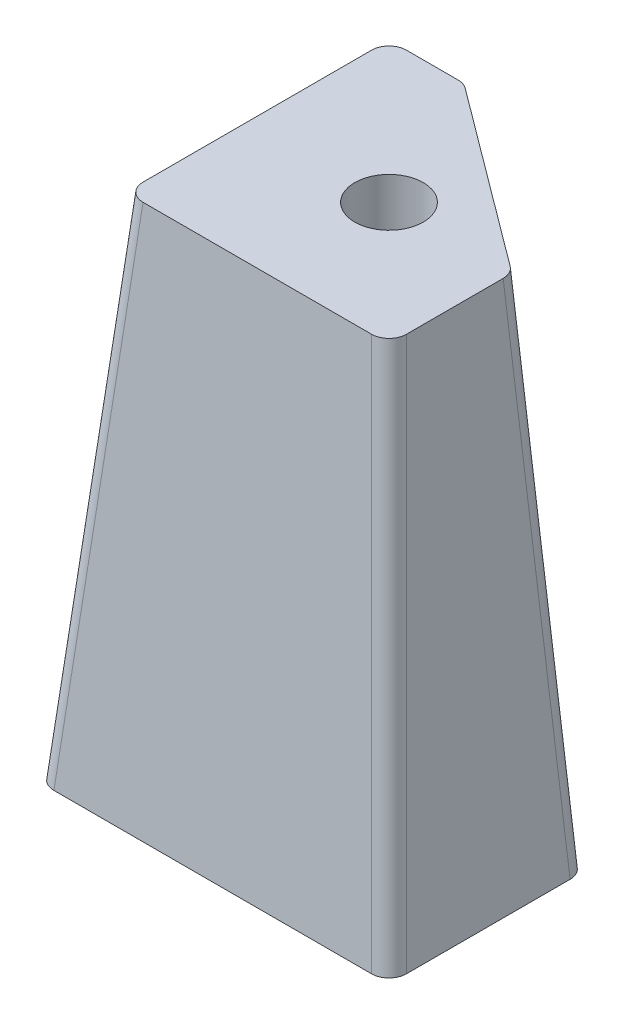
from build123d import *

# Parameters (mm, degrees)
BOSS_EXTRUDE1_DEPTH = 29
SKETCH2_R           = 2
SKETCH2_R_2         = 1.5
CUT_EXTRUDE1_DEPTH  = 10
SKETCH3_R           = 1.95
CUT_EXTRUDE2_DEPTH  = 6
DRAFT1_ANGLE        = 5
FILLET1_R           = 1


with BuildPart() as part:
    # Sketch1 → Boss-Extrude1 (new body)
    with BuildSketch(Plane(origin=(0, 0, 0), x_dir=(1, 0, 0), z_dir=(0, 1, 0))):
        Polygon((10.420353982, -7.201327434), (-4.579646018, -7.201327434), (-4.579646018, 7.798672566), (-0.312469404, 7.798672566), (10.420353982, -0.201327434), align=None)
    extrude(amount=BOSS_EXTRUDE1_DEPTH)

    # Sketch2 → Cut-Extrude1 (cut)
    with BuildSketch(Plane.XZ):
        with Locations(Location((-0.579646018, 2.201327434, 0), (0, 0, 270))):
            Circle(SKETCH2_R)
        with Locations(Location((7.420353982, 2.201327434, 0), (0, 0, 270))):
            Circle(SKETCH2_R_2)
    extrude(amount=-CUT_EXTRUDE1_DEPTH, mode=Mode.SUBTRACT)

    # Sketch3 → Cut-Extrude2 (cut)
    with BuildSketch(Plane(origin=(0, 29, 0), x_dir=(1, 0, 0), z_dir=(0, 1, 0))):
        with Locations(Location((3.420353982, -0.201327434, 0), (0, 0, 270))):
            Circle(SKETCH3_R)
    extrude(amount=-CUT_EXTRUDE2_DEPTH, mode=Mode.SUBTRACT)

    # Draft1
    draft1_faces = [part.faces().sort_by_distance(p)[0] for p in [
        (5.053942289, 14.5, -3.798672566),
        (-2.446057711, 14.5, -7.798672566),
        (-4.579646018, 14.5, -0.298672566),
        (10.420353982, 14.5, 3.701327434),
        (2.920353982, 14.5, 7.201327434),
    ]]
    draft(draft1_faces, Plane.ZX.offset(29), DRAFT1_ANGLE)

    # Fillet1
    fillet1_edges = [part.edges().sort_by_distance(p)[0] for p in [
        (0.108303665, 14.5, -9.067258187),
        (11.688939603, 14.5, -0.435318187),
        (11.688939603, 14.5, 8.469913055),
        (-5.848231639, 14.5, 8.469913055),
        (-5.848231639, 14.5, -9.067258187),
    ]]
    fillet(fillet1_edges, radius=FILLET1_R)


solid = part.part
